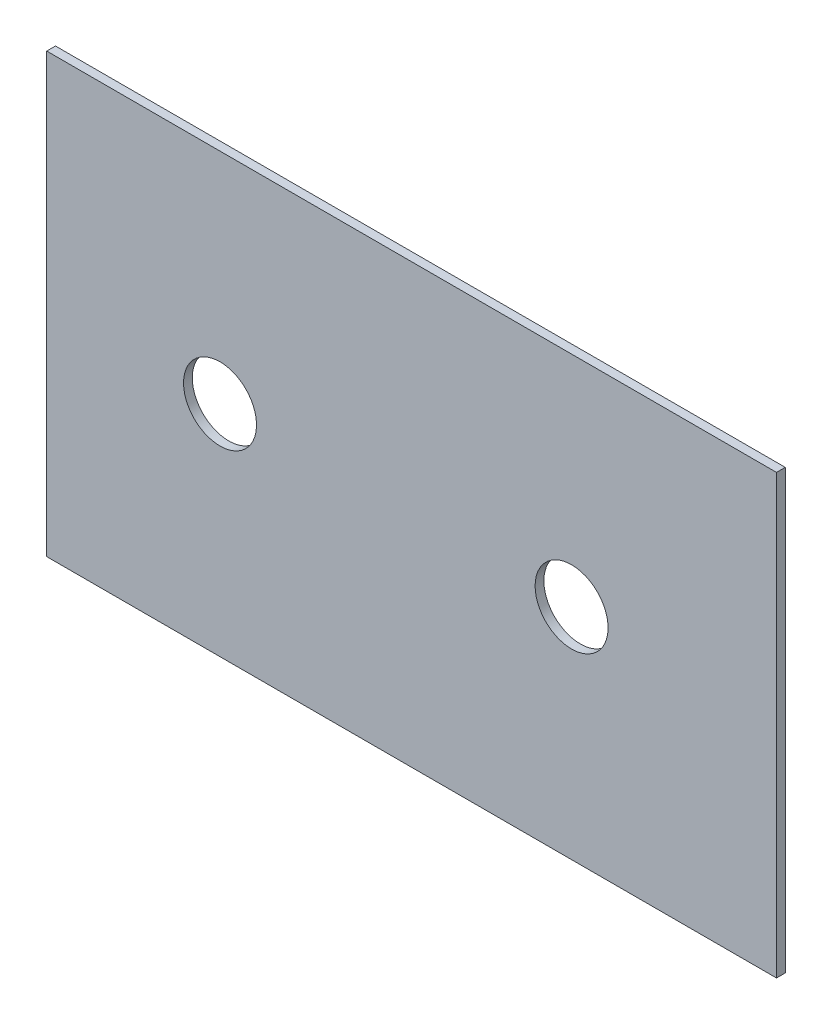
from build123d import *

# Parameters (mm, degrees)
SKETCH1_W           = 127
SKETCH1_H           = 76.2
BOSS_EXTRUDE1_DEPTH = 1.524
SKETCH2_R           = 6.35
CUT_EXTRUDE1_DEPTH  = 1.524


with BuildPart() as part:
    # Sketch1 → Boss-Extrude1 (new body)
    with BuildSketch(Plane.XY):
        Rectangle(SKETCH1_W, SKETCH1_H)
    extrude(amount=BOSS_EXTRUDE1_DEPTH)

    # Sketch2 → Cut-Extrude1 (cut)
    with BuildSketch(Plane(origin=(0, 0, 0), x_dir=(-1, 0, 0), z_dir=(0, 0, -1))):
        with Locations((-27.840556527, 0)):
            Circle(SKETCH2_R)
        with Locations((33.34417465, 0)):
            Circle(SKETCH2_R)
    extrude(amount=-CUT_EXTRUDE1_DEPTH, mode=Mode.SUBTRACT)


solid = part.part
